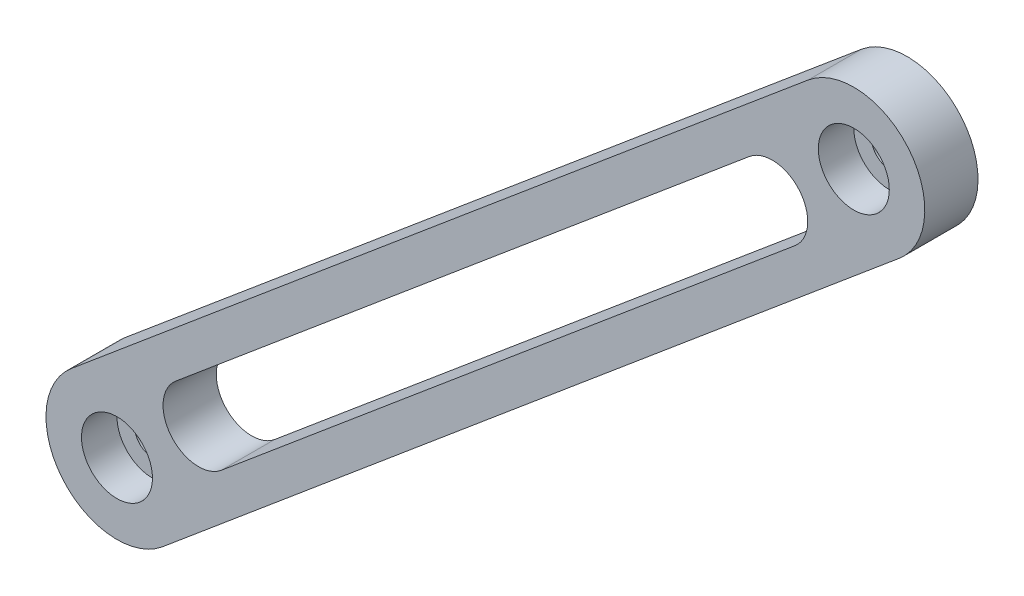
from build123d import *

# Parameters (mm, degrees)
SKETCH1_R           = 6.35
BOSS_EXTRUDE1_DEPTH = 19.05
SKETCH2_R           = 12.7
CUT_EXTRUDE1_DEPTH  = 12.7


with BuildPart() as part:
    # Sketch1 → Boss-Extrude1 (new body)
    with BuildSketch(Plane.XY):
        with BuildLine():
            Line((568.345160721, 503.256723569), (304.695644733, 282.028511943))
            ThreePointArc((304.695644733, 282.028511943), (301.564919628, 246.244179632), (337.349251645, 243.113451162))
            Line((337.349251645, 243.113451162), (600.998771294, 464.341665859))
            ThreePointArc((600.998771294, 464.341665859), (604.129494863, 500.126), (568.345160721, 503.256723569))
        make_face()
        with Locations(Location((321.022448189, 262.570981553, 0), (0, 0, 180))):
            Circle(SKETCH1_R, mode=Mode.SUBTRACT)
        with Locations(Location((584.671966007, 483.799194714, 0), (0, 0, 180))):
            Circle(SKETCH1_R, mode=Mode.SUBTRACT)
        with BuildLine():
            Line((563.649075368, 449.580222357), (358.372145945, 277.33242659))
            ThreePointArc((358.372145945, 277.33242659), (340.479978874, 278.897788374), (342.045340659, 296.789955445))
            Line((342.045340659, 296.789955445), (547.322270082, 469.037751213))
            ThreePointArc((547.322270082, 469.037751213), (565.214437152, 467.472389428), (563.649075368, 449.580222357))
        make_face(mode=Mode.SUBTRACT)
    extrude(amount=BOSS_EXTRUDE1_DEPTH)

    # Sketch2 → Cut-Extrude1 (cut)
    with BuildSketch(Plane.XY.offset(19.05)):
        with Locations((321.022448189, 262.570981553)):
            Circle(SKETCH2_R)
        with Locations((584.671966007, 483.799194714)):
            Circle(SKETCH2_R)
    extrude(amount=-CUT_EXTRUDE1_DEPTH, mode=Mode.SUBTRACT)


solid = part.part
